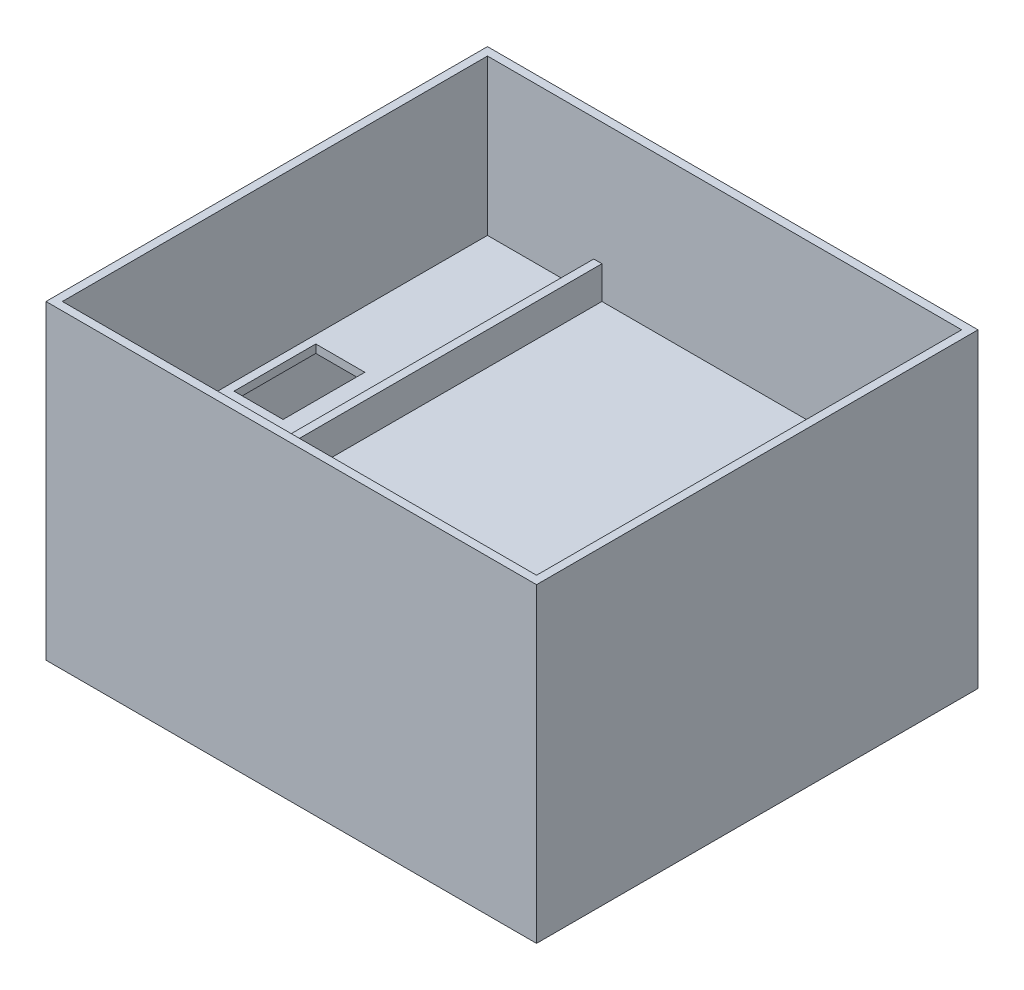
from build123d import *

# Parameters (mm, degrees)
SKETCH1_W           = 60
SKETCH1_H           = 54
BOSS_EXTRUDE1_DEPTH = 38
SKETCH2_W           = 44
SKETCH2_H           = 52
CUT_EXTRUDE1_DEPTH  = 19
SKETCH3_W           = 35
SKETCH3_H           = 52
CUT_EXTRUDE2_DEPTH  = 18
SKETCH4_W           = 6
SKETCH4_H           = 10
CUT_EXTRUDE3_DEPTH  = 38
SKETCH5_W           = 14
SKETCH5_H           = 52
CUT_EXTRUDE5_DEPTH  = 15
SKETCH6_W           = 13
SKETCH6_H           = 52
CUT_EXTRUDE6_DEPTH  = 4


with BuildPart() as part:
    # Sketch1 → Boss-Extrude1 (new body)
    with BuildSketch(Plane(origin=(0, 0, 0), x_dir=(1, 0, 0), z_dir=(0, 1, 0))):
        with Locations((-83.874465942, -33.946435202)):
            Rectangle(SKETCH1_W, SKETCH1_H)
    extrude(amount=BOSS_EXTRUDE1_DEPTH)

    # Sketch2 → Cut-Extrude1 (cut)
    with BuildSketch(Plane(origin=(0, 38, 0), x_dir=(1, 0, 0), z_dir=(0, 1, 0))):
        with Locations((-76.874465942, -33.946435202)):
            Rectangle(SKETCH2_W, SKETCH2_H)
    extrude(amount=-CUT_EXTRUDE1_DEPTH, mode=Mode.SUBTRACT)

    # Sketch3 → Cut-Extrude2 (cut)
    with BuildSketch(Plane(origin=(0, 0, 0), x_dir=(-1, 0, 0), z_dir=(0, -1, 0))):
        with Locations((95.374465942, -33.946435202)):
            Rectangle(SKETCH3_W, SKETCH3_H)
    extrude(amount=-CUT_EXTRUDE2_DEPTH, mode=Mode.SUBTRACT)

    # Sketch4 → Cut-Extrude3 (cut)
    with BuildSketch(Plane(origin=(0, 18, 0), x_dir=(-1, 0, 0), z_dir=(0, -1, 0))):
        with Locations((108.874465942, -34.946435202)):
            Rectangle(SKETCH4_W, SKETCH4_H)
    extrude(amount=-CUT_EXTRUDE3_DEPTH, mode=Mode.SUBTRACT)

    # Sketch5 → Cut-Extrude5 (cut)
    with BuildSketch(Plane(origin=(0, 38, 0), x_dir=(1, 0, 0), z_dir=(0, 1, 0))):
        with Locations((-105.874465942, -33.946435202)):
            Rectangle(SKETCH5_W, SKETCH5_H)
    extrude(amount=-CUT_EXTRUDE5_DEPTH, mode=Mode.SUBTRACT)

    # Sketch6 → Cut-Extrude6 (cut)
    with BuildSketch(Plane(origin=(0, 23, 0), x_dir=(1, 0, 0), z_dir=(0, 1, 0))):
        with Locations((-106.374465942, -33.946435202)):
            Rectangle(SKETCH6_W, SKETCH6_H)
    extrude(amount=-CUT_EXTRUDE6_DEPTH, mode=Mode.SUBTRACT)


solid = part.part
